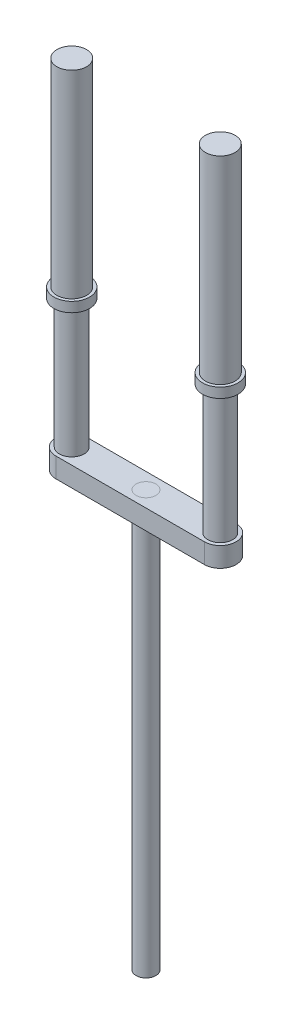
from build123d import *

# Parameters (mm, degrees)
SKETCH1_R                = 10
SKETCH1_R_2              = 12.5
BOSS_EXTRUDE1_DEPTH      = 20
BOSS_EXTRUDE2_DEPTH      = 20
BOSS_EXTRUDE2_DEPTH_BACK = 400
SKETCH1_3_R              = 10
SKETCH1_5_R              = 12.5
BOSS_EXTRUDE3_DEPTH      = 360
SKETCH3_R                = 15
BOSS_EXTRUDE4_DEPTH      = 200
SKETCH4_R                = 18
BOSS_EXTRUDE5_DEPTH      = 10


with BuildPart() as part:
    # Sketch1 → Boss-Extrude1 (new body)
    with BuildSketch(Plane(origin=(0, 0, 0), x_dir=(1, 0, 0), z_dir=(0, 1, 0))):
        with BuildLine():
            Line((-75, 16), (75, 16))
            ThreePointArc((75, 16), (91, 0), (75, -16))
            Line((75, -16), (-75, -16))
            ThreePointArc((-75, -16), (-91, 0), (-75, 16))
        make_face()
        Circle(SKETCH1_R, mode=Mode.SUBTRACT)
        with Locations((75, 0)):
            Circle(SKETCH1_R_2, mode=Mode.SUBTRACT)
        with Locations((-75, 0)):
            Circle(SKETCH1_R_2, mode=Mode.SUBTRACT)
    extrude(amount=BOSS_EXTRUDE1_DEPTH)

    # Sketch1<5> → Boss-Extrude3 (add)
    with BuildSketch(Plane(origin=(0, 0, 0), x_dir=(1, 0, 0), z_dir=(0, 1, 0))):
        with Locations((75, 0)):
            Circle(SKETCH1_5_R)
        with Locations((-75, 0)):
            Circle(SKETCH1_5_R)
    extrude(amount=BOSS_EXTRUDE3_DEPTH)

    # Sketch3 → Boss-Extrude4 (add)
    with BuildSketch(Plane(origin=(0, 360, 0), x_dir=(1, 0, 0), z_dir=(0, 1, 0))):
        with Locations((75, 0)):
            Circle(SKETCH3_R)
        with Locations((-75, 0)):
            Circle(SKETCH3_R)
    extrude(amount=-BOSS_EXTRUDE4_DEPTH)

    # Sketch4 → Boss-Extrude5 (add)
    with BuildSketch(Plane.XZ.offset(-160)):
        with Locations((-75, 0)):
            Circle(SKETCH4_R)
        with Locations((75, 0)):
            Circle(SKETCH4_R)
    extrude(amount=BOSS_EXTRUDE5_DEPTH)


with BuildPart() as body_2:
    # Sketch1<3> → Boss-Extrude2 (new, two sides: drawn at the far end of the back side and taken through both)
    with BuildSketch(Plane(origin=(0, 0, 0), x_dir=(1, 0, 0), z_dir=(0, 1, 0)).offset(-BOSS_EXTRUDE2_DEPTH_BACK)):
        Circle(SKETCH1_3_R)
    extrude(amount=BOSS_EXTRUDE2_DEPTH + BOSS_EXTRUDE2_DEPTH_BACK)


solid = Compound([part.part, body_2.part])
